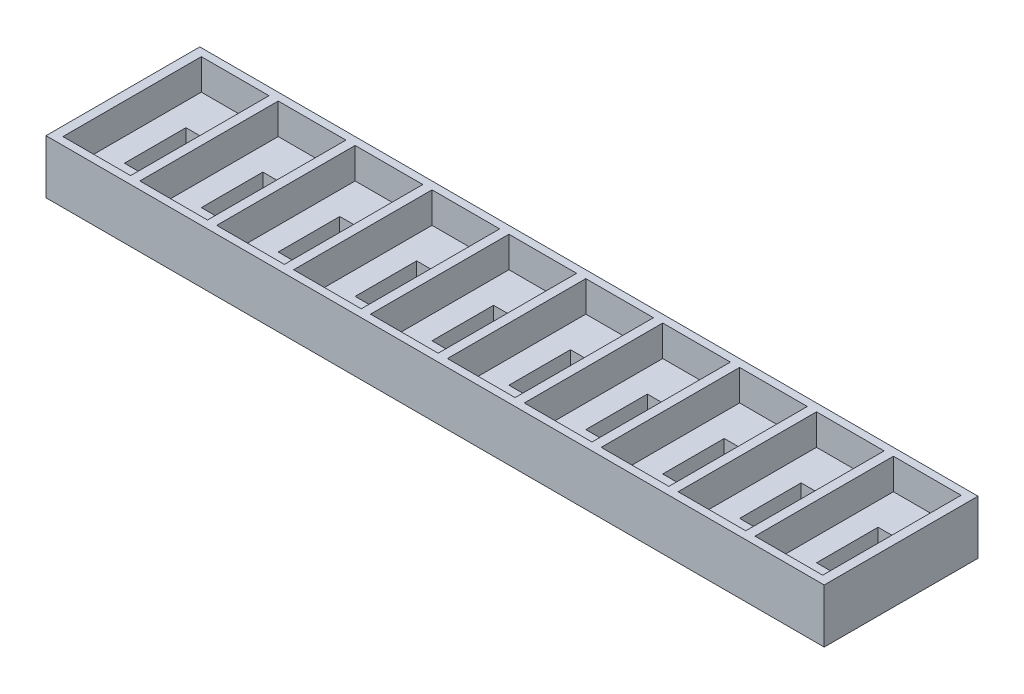
from build123d import *

# Parameters (mm, degrees)
SKETCH1_W           = 253
SKETCH1_H           = 50
BOSS_EXTRUDE1_DEPTH = 17.5
SKETCH2_W           = 22
SKETCH2_H           = 45
CUT_EXTRUDE1_DEPTH  = 10
SKETCH3_W           = 14.5
SKETCH3_H           = 20
CUT_EXTRUDE2_DEPTH  = 17.5
LPATTERN1_COUNT     = 10
LPATTERN1_PITCH     = 25


with BuildPart() as part:
    # Sketch1 → Boss-Extrude1 (new body)
    with BuildSketch(Plane(origin=(0, 0, 0), x_dir=(1, 0, 0), z_dir=(0, 1, 0))):
        with Locations((126.5, -25)):
            Rectangle(SKETCH1_W, SKETCH1_H)
    extrude(amount=BOSS_EXTRUDE1_DEPTH)

    # Sketch2 → Cut-Extrude1 (cut)
    with BuildSketch(Plane(origin=(0, 17.5, 0), x_dir=(1, 0, 0), z_dir=(0, 1, 0))):
        with Locations((14, -25)):
            Rectangle(SKETCH2_W, SKETCH2_H)
    cut_extrude1 = extrude(amount=-CUT_EXTRUDE1_DEPTH, mode=Mode.SUBTRACT)

    # Sketch3 → Cut-Extrude2 (cut)
    with BuildSketch(Plane(origin=(0, 17.5, 0), x_dir=(1, 0, 0), z_dir=(0, 1, 0))):
        with Locations((17.75, -25)):
            Rectangle(SKETCH3_W, SKETCH3_H)
    cut_extrude2 = extrude(amount=-CUT_EXTRUDE2_DEPTH, mode=Mode.SUBTRACT)

    # LPattern1: Cut-Extrude1, Cut-Extrude2 ×10
    with Locations(*[(i * LPATTERN1_PITCH, 0, 0) for i in range(1, LPATTERN1_COUNT)]):
        add(cut_extrude1, mode=Mode.SUBTRACT)
        add(cut_extrude2, mode=Mode.SUBTRACT)


solid = part.part
